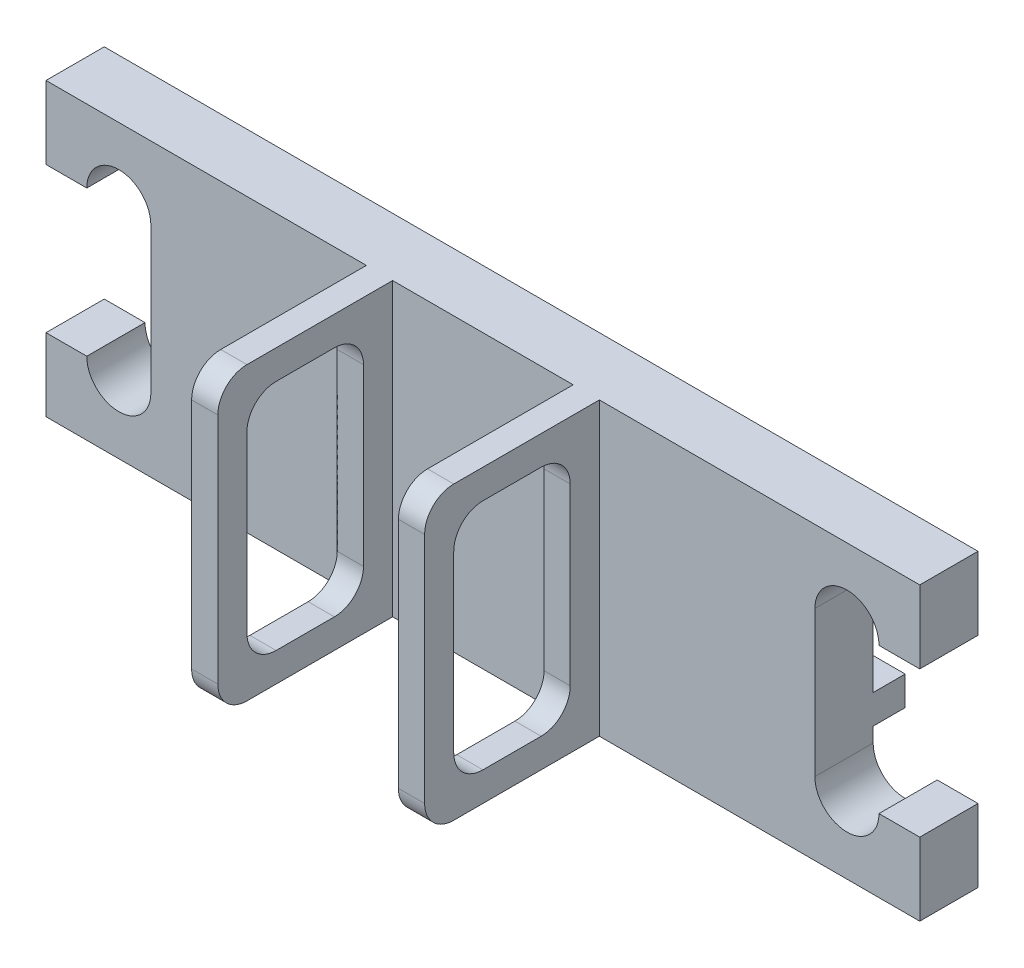
from build123d import *

# Parameters (mm, degrees)
CROQUIS1_W              = 30
CROQUIS1_H              = 10
SALIENTE_EXTRUIR1_DEPTH = 2
CORTAR_EXTRUIR2_DEPTH   = 11
CROQUIS3_W              = 11.193843072
CROQUIS3_H              = 1
CROQUIS3_W_2            = 11.806156928
SALIENTE_EXTRUIR3_DEPTH = 1.5
CORTAR_EXTRUIR3_DEPTH   = 11.5
CROQUIS5_W              = 1.4
CROQUIS5_H              = 5
CORTAR_EXTRUIR4_DEPTH   = 10
CROQUIS6_W              = 8
CROQUIS6_H              = 5
SALIENTE_EXTRUIR4_DEPTH = 6
CROQUIS7_W              = 6.2
CROQUIS7_H              = 6
CORTAR_EXTRUIR5_DEPTH   = 11
CORTAR_EXTRUIR6_DEPTH   = 11
REDONDEO1_R             = 1
CROQUIS9_W              = 0.4
CROQUIS9_H              = 1
CORTAR_EXTRUIR7_DEPTH   = 23


with BuildPart() as part:
    # Croquis1 → Saliente-Extruir1 (new body)
    with BuildSketch(Plane.XY):
        Rectangle(CROQUIS1_W, CROQUIS1_H)
    extrude(amount=SALIENTE_EXTRUIR1_DEPTH)

    # Croquis2 → Cortar-Extruir2 (cut)
    with BuildSketch(Plane.XY.offset(2)):
        with BuildLine():
            Line((-13.5, -2.5), (-13.5, 2.5))
            ThreePointArc((-13.5, 2.5), (-12.5, 3.5), (-11.5, 2.5))
            Line((-11.5, 2.5), (-11.5, -2.5))
            ThreePointArc((-11.5, -2.5), (-12.5, -3.5), (-13.5, -2.5))
        make_face()
        with BuildLine():
            Line((11.5, 2.5), (11.5, -2.5))
            ThreePointArc((11.5, -2.5), (12.5, -3.5), (13.5, -2.5))
            Line((13.5, -2.5), (13.5, 2.5))
            ThreePointArc((13.5, 2.5), (12.5, 3.5), (11.5, 2.5))
        make_face()
    extrude(amount=-CORTAR_EXTRUIR2_DEPTH, mode=Mode.SUBTRACT)

    # Croquis3 → Saliente-Extruir3 (add)
    with BuildSketch(Plane(origin=(0, 0, 0), x_dir=(-1, 0, 0), z_dir=(0, 0, -1))):
        with Locations((5.903078464, -1.5)):
            Rectangle(CROQUIS3_W, CROQUIS3_H)
        with Locations((-5.596921536, -1.5)):
            Rectangle(CROQUIS3_W_2, CROQUIS3_H)
    extrude(amount=SALIENTE_EXTRUIR3_DEPTH)

    # Croquis4 → Cortar-Extruir3 (cut)
    with BuildSketch(Plane.XY.offset(2)):
        with BuildLine():
            Line((-13.6, 2.5), (-13.6, -2.5))
            ThreePointArc((-13.6, -2.5), (-12.5, -3.6), (-11.4, -2.5))
            Line((-11.4, -2.5), (-11.4, 2.5))
            ThreePointArc((-11.4, 2.5), (-12.5, 3.6), (-13.6, 2.5))
        make_face()
        with BuildLine():
            Line((11.4, 2.5), (11.4, -2.5))
            ThreePointArc((11.4, -2.5), (12.5, -3.6), (13.6, -2.5))
            Line((13.6, -2.5), (13.6, 2.5))
            ThreePointArc((13.6, 2.5), (12.5, 3.6), (11.4, 2.5))
        make_face()
    extrude(amount=-CORTAR_EXTRUIR3_DEPTH, mode=Mode.SUBTRACT)

    # Croquis5 → Cortar-Extruir4 (cut)
    with BuildSketch(Plane.XY.offset(2)):
        with Locations((-14.3, 0)):
            Rectangle(CROQUIS5_W, CROQUIS5_H)
        with Locations((14.3, 0)):
            Rectangle(CROQUIS5_W, CROQUIS5_H)
    extrude(amount=-CORTAR_EXTRUIR4_DEPTH, mode=Mode.SUBTRACT)

    # Croquis6 → Saliente-Extruir4 (add)
    with BuildSketch(Plane.XY.offset(2)):
        with Locations((0, 2.5)):
            Rectangle(CROQUIS6_W, CROQUIS6_H)
        with Locations((0, -2.5)):
            Rectangle(CROQUIS6_W, CROQUIS6_H)
    extrude(amount=SALIENTE_EXTRUIR4_DEPTH)

    # Croquis7 → Cortar-Extruir5 (cut)
    with BuildSketch(Plane(origin=(0, 5, 0), x_dir=(1, 0, 0), z_dir=(0, 1, 0))):
        with Locations((0, -5)):
            Rectangle(CROQUIS7_W, CROQUIS7_H)
    extrude(amount=-CORTAR_EXTRUIR5_DEPTH, mode=Mode.SUBTRACT)

    # Croquis8 → Cortar-Extruir6 (cut)
    with BuildSketch(Plane.ZY.offset(4)):
        with BuildLine():
            Line((5, -4), (5, 4))
            Line((5, 4), (4, 4))
            ThreePointArc((4, 4), (3.292893219, 3.707106781), (3, 3))
            Line((3, 3), (3, -3))
            ThreePointArc((3, -3), (3.292893219, -3.707106781), (4, -4))
            Line((4, -4), (5, -4))
        make_face()
        with BuildLine():
            Line((6, 4), (5, 4))
            Line((5, 4), (5, -4))
            Line((5, -4), (6, -4))
            ThreePointArc((6, -4), (6.707106781, -3.707106781), (7, -3))
            Line((7, -3), (7, 3))
            ThreePointArc((7, 3), (6.707106781, 3.707106781), (6, 4))
        make_face()
    extrude(amount=-CORTAR_EXTRUIR6_DEPTH, mode=Mode.SUBTRACT)

    # Redondeo1
    redondeo1_edges = [part.edges().sort_by_distance(p)[0] for p in [
        (3.55, 5, 8),
        (-3.55, -5, 8),
        (-3.55, 5, 8),
        (3.55, -5, 8),
    ]]
    fillet(redondeo1_edges, radius=REDONDEO1_R)

    # Croquis9 → Cortar-Extruir7 (cut)
    with BuildSketch(Plane(origin=(11.4, 0, 0), x_dir=(0, 0, -1), z_dir=(1, 0, 0))):
        with Locations((1.3, -1.5)):
            Rectangle(CROQUIS9_W, CROQUIS9_H)
    extrude(amount=-CORTAR_EXTRUIR7_DEPTH, mode=Mode.SUBTRACT)


solid = part.part
